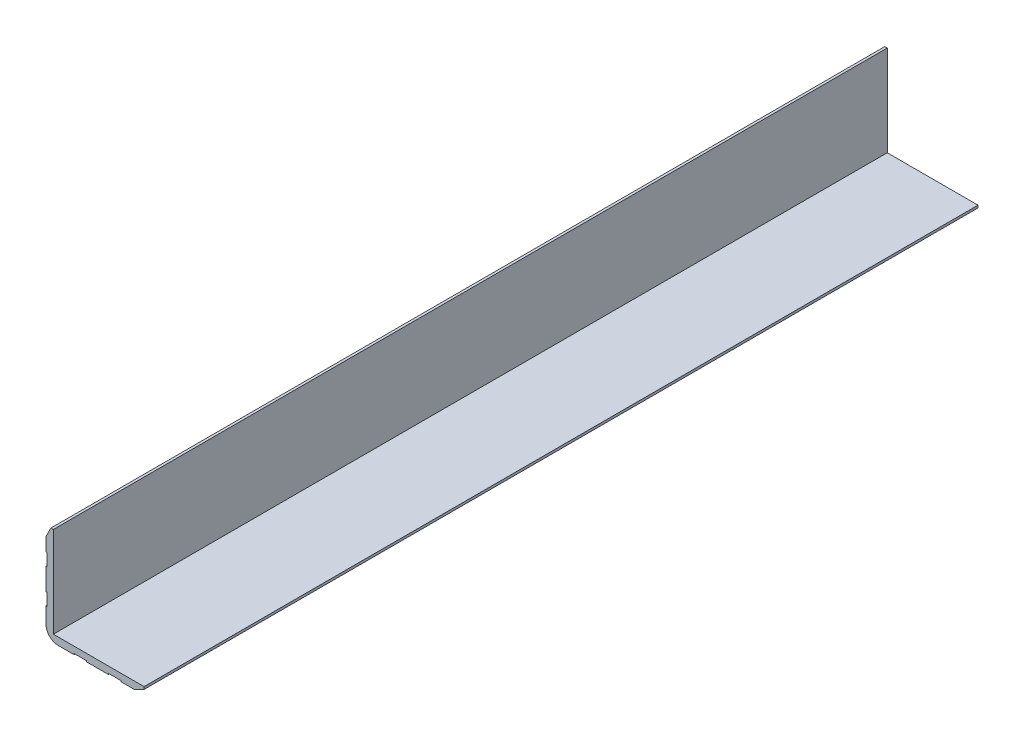
from build123d import *

# Parameters (mm, degrees)
LENGTH_DEPTH = 170


with BuildPart() as part:
    # Sketch1 → Length (new body)
    with BuildSketch(Plane.XY):
        with BuildLine():
            Line((0, 0), (0, 18.5))
            Line((0, 18.5), (-0.5, 18.5))
            Line((-0.5, 18.5), (-1.5, 16.5))
            Line((-1.5, 16.5), (-1.5, 13.75))
            Line((-1.5, 13.75), (-1.3, 13.75))
            Line((-1.3, 13.75), (-1.3, 11.25))
            Line((-1.3, 11.25), (-1.5, 11.25))
            Line((-1.5, 11.25), (-1.5, 6.75))
            Line((-1.5, 6.75), (-1.3, 6.75))
            Line((-1.3, 6.75), (-1.3, 4.25))
            Line((-1.3, 4.25), (-1.5, 4.25))
            Line((-1.5, 4.25), (-1.5, 1))
            ThreePointArc((-1.5, 1), (-0.767766953, -0.767766953), (1, -1.5))
            Line((1, -1.5), (4.25, -1.5))
            Line((4.25, -1.5), (4.25, -1.3))
            Line((4.25, -1.3), (6.75, -1.3))
            Line((6.75, -1.3), (6.75, -1.5))
            Line((6.75, -1.5), (11.25, -1.5))
            Line((11.25, -1.5), (11.25, -1.3))
            Line((11.25, -1.3), (13.75, -1.3))
            Line((13.75, -1.3), (13.75, -1.5))
            Line((13.75, -1.5), (16.5, -1.5))
            Line((16.5, -1.5), (18.5, -0.5))
            Line((18.5, -0.5), (18.5, 0))
            Line((18.5, 0), (0, 0))
        make_face()
    extrude(amount=LENGTH_DEPTH)


solid = part.part
